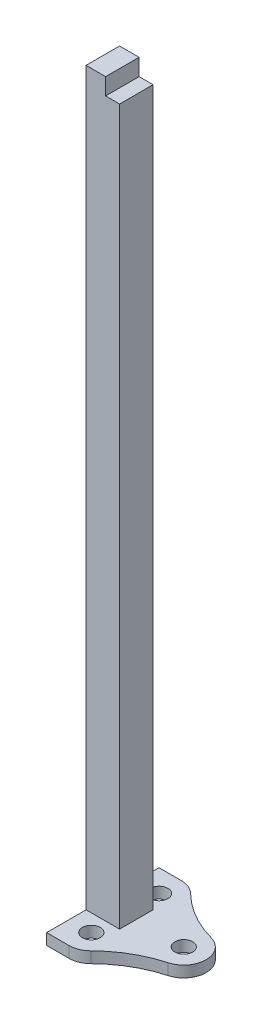
from build123d import *

# Parameters (mm, degrees)
SKETCH_1_R      = 1.6
EXTRUDE_1_DEPTH = 2
SKETCH_3_W      = 6
SKETCH_3_H      = 6
EXTRUDE_3_DEPTH = 130
SKETCH_4_W      = 3.5
SKETCH_4_H      = 6
EXTRUDE_4_DEPTH = 3
EXTRUDE_6_DEPTH = 2


with BuildPart() as part:
    # 草图1 → 凸台-拉伸1 (new body)
    with BuildSketch(Plane(origin=(0, 0, 0), x_dir=(1, 0, 0), z_dir=(0, 1, 0))):
        with BuildLine():
            ThreePointArc((8.06014642, -3.856953405), (11, 0), (8.06014642, 3.856953405))
            ThreePointArc((8.06014642, 3.856953405), (3.36087852, 5.821212354), (-0.68985358, 8.90876826))
            ThreePointArc((-0.68985358, 8.90876826), (-5.5, 9.526279442), (-7.37029284, 5.051814855))
            ThreePointArc((-7.37029284, 5.051814855), (-6.721757039, 0), (-7.37029284, -5.051814855))
            ThreePointArc((-7.37029284, -5.051814855), (-5.5, -9.526279442), (-0.68985358, -8.90876826))
            ThreePointArc((-0.68985358, -8.90876826), (3.36087852, -5.821212354), (8.06014642, -3.856953405))
        make_face()
        with Locations(Location((7, 0, 0), (0, 0, 270))):
            Circle(SKETCH_1_R, mode=Mode.SUBTRACT)
        with Locations(Location((-3.5, -6.062177826, 0), (0, 0, 270))):
            Circle(SKETCH_1_R, mode=Mode.SUBTRACT)
        with Locations(Location((-3.5, 6.062177826, 0), (0, 0, 270))):
            Circle(SKETCH_1_R, mode=Mode.SUBTRACT)
    extrude(amount=EXTRUDE_1_DEPTH)

    # 草图3 → 凸台-拉伸3 (add)
    with BuildSketch(Plane(origin=(0, 0, 0), x_dir=(1, 0, 0), z_dir=(0, 1, 0))):
        with Locations((-4.5, 0)):
            Rectangle(SKETCH_3_W, SKETCH_3_H)
    extrude(amount=EXTRUDE_3_DEPTH)

    # 草图4 → 凸台-拉伸4 (add)
    with BuildSketch(Plane(origin=(0, 130, 0), x_dir=(1, 0, 0), z_dir=(0, 1, 0))):
        with Locations((-5.75, 0)):
            Rectangle(SKETCH_4_W, SKETCH_4_H)
    extrude(amount=EXTRUDE_4_DEPTH)

    # 草图5 → 凸台-拉伸6 (add)
    with BuildSketch(Plane(origin=(0, 2, 0), x_dir=(1, 0, 0), z_dir=(0, 1, 0))):
        Polygon((-7.5, 6.062177826), (-7.5, -6.062177826), (-7.5, -10.062177826), (-3.5, -10.062177826), (-6.276889943, -8.064926479), (-6.276889943, 5.727222141), (-3.5, 10.062177826), (-7.5, 10.062177826), align=None)
    extrude(amount=-EXTRUDE_6_DEPTH)


solid = part.part
